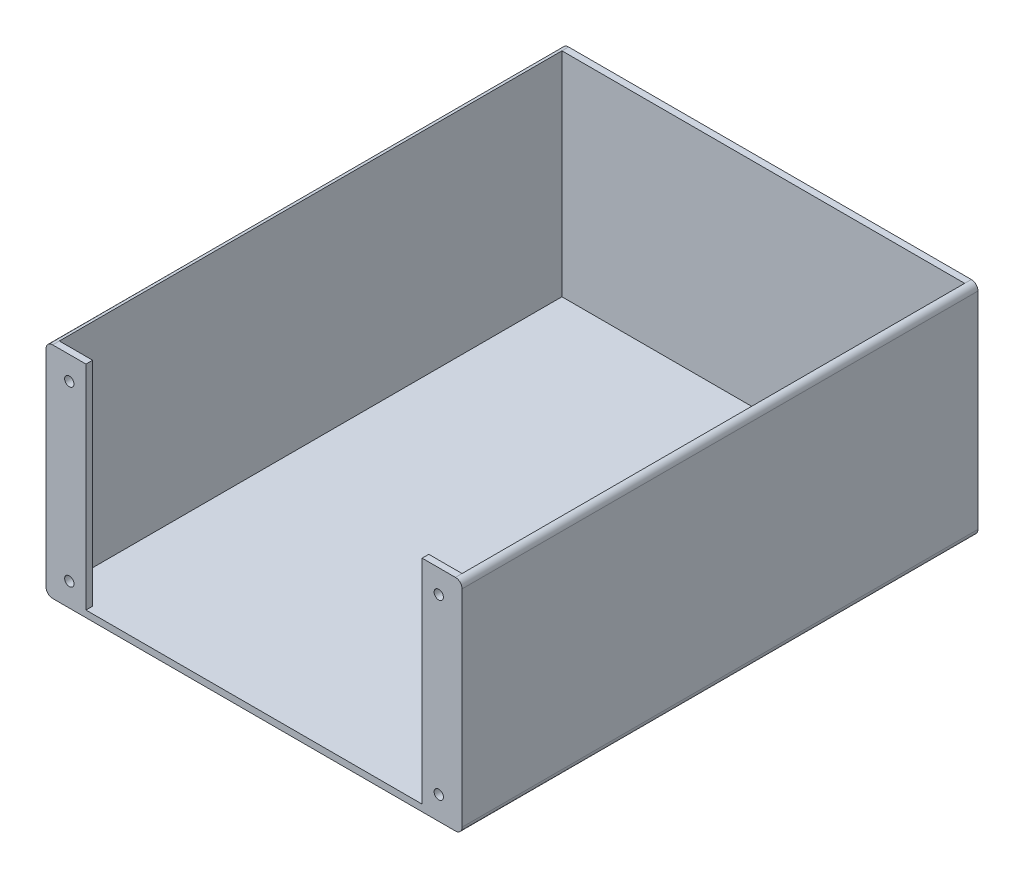
from build123d import *

# Parameters (mm, degrees)
SKETCH1_W           = 125
SKETCH1_H           = 66
BOSS_EXTRUDE1_DEPTH = 155
FILLET1_R           = 2
SKETCH7_R           = 1.4
CUT_EXTRUDE4_DEPTH  = 15
SKETCH4_W           = 121
SKETCH4_H           = 151
CUT_EXTRUDE5_DEPTH  = 64
SKETCH8_W           = 101
SKETCH8_H           = 64.031377795
CUT_EXTRUDE6_DEPTH  = 64


with BuildPart() as part:
    # Sketch1 → Boss-Extrude1 (new body)
    with BuildSketch(Plane.XY):
        with Locations((-19.516389056, 19.409080835)):
            Rectangle(SKETCH1_W, SKETCH1_H)
    extrude(amount=BOSS_EXTRUDE1_DEPTH)

    # Fillet1
    fillet1_edges = [part.edges().sort_by_distance(p)[0] for p in [
        (-82.016389056, 52.409080835, 77.5),
        (42.983610944, 52.409080835, 77.5),
        (42.983610944, -13.590919165, 77.5),
        (-82.016389056, -13.590919165, 77.5),
    ]]
    fillet(fillet1_edges, radius=FILLET1_R)

    # Sketch7 → Cut-Extrude4 (cut)
    with BuildSketch(Plane.XY.offset(155)):
        with Locations((-75.016389056, 45.409080835)):
            Circle(SKETCH7_R)
        with Locations((-75.016389056, -6.590919165)):
            Circle(SKETCH7_R)
        with Locations((35.983610944, -6.590919165)):
            Circle(SKETCH7_R)
        with Locations((35.983610944, 45.409080835)):
            Circle(SKETCH7_R)
    extrude(amount=-CUT_EXTRUDE4_DEPTH, mode=Mode.SUBTRACT)

    # Sketch4 → Cut-Extrude5 (cut)
    with BuildSketch(Plane(origin=(0, 52.409080835, 0), x_dir=(1, 0, 0), z_dir=(0, 1, 0))):
        with Locations((-19.516389056, -77.5)):
            Rectangle(SKETCH4_W, SKETCH4_H)
    extrude(amount=-CUT_EXTRUDE5_DEPTH, mode=Mode.SUBTRACT)

    # Sketch8 → Cut-Extrude6 (cut)
    with BuildSketch(Plane.XY.offset(155)):
        with Locations((-19.516389056, 20.424769732)):
            Rectangle(SKETCH8_W, SKETCH8_H)
    extrude(amount=-CUT_EXTRUDE6_DEPTH, mode=Mode.SUBTRACT)


solid = part.part
